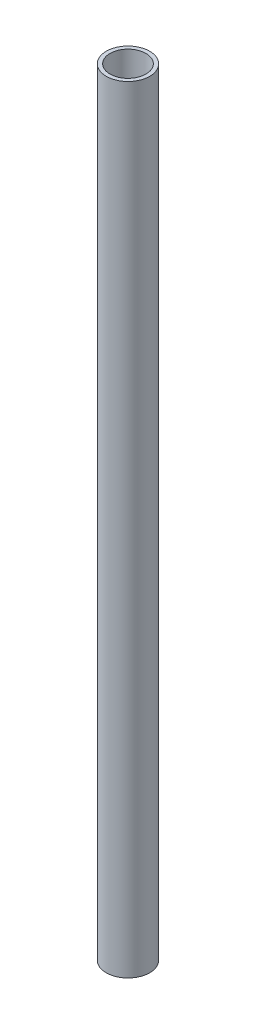
from build123d import *

# Parameters (mm, degrees)
SKETCH_1_R      = 12.6
EXTRUDE_1_DEPTH = 450
SHELL_1_T       = -2.2


with BuildPart() as part:
    # 스케치1 → 보스-돌출1 (new body)
    with BuildSketch(Plane(origin=(0, 0, 0), x_dir=(1, 0, 0), z_dir=(0, 1, 0))):
        with Locations(Location((0, 0, 0), (0, 0, 270))):
            Circle(SKETCH_1_R)
    extrude(amount=EXTRUDE_1_DEPTH)

    # 쉘1
    shell_1_openings = [part.faces().sort_by_distance(p)[0] for p in [
        (0, 450, 0),
        (0, 0, 0),
    ]]
    offset(amount=SHELL_1_T, openings=shell_1_openings, kind=Kind.INTERSECTION)


solid = part.part
